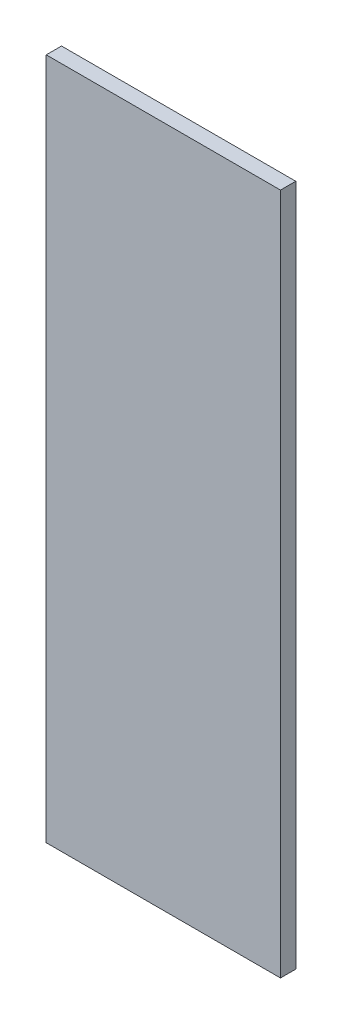
from build123d import *

# Parameters (mm, degrees)
ESBO_O1_W                = 23
ESBO_O1_H                = 67
RESSALTO_EXTRUS_O1_DEPTH = 1.5


with BuildPart() as part:
    # Esboço1 → Ressalto-extrusão1 (new body)
    with BuildSketch(Plane.XY):
        Rectangle(ESBO_O1_W, ESBO_O1_H)
    extrude(amount=RESSALTO_EXTRUS_O1_DEPTH)


solid = part.part
